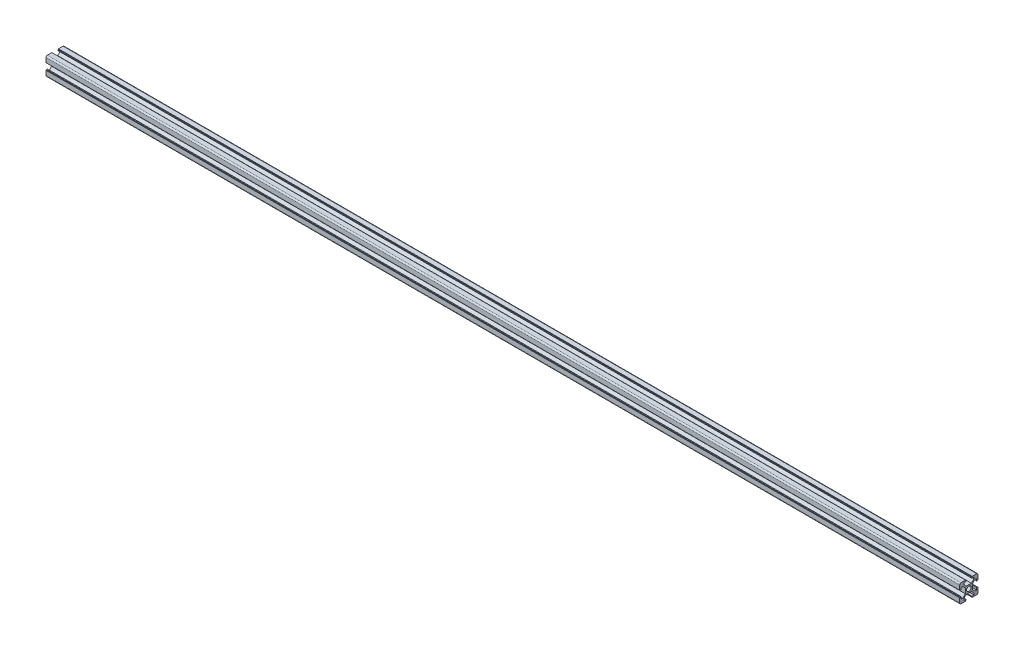
from build123d import *

# Parameters (mm, degrees)
SKETCH1_R                = 2.5
F_20_X_20_X_R1_5_1_DEPTH = 1000


with BuildPart() as part:
    # Sketch1 → 铝型材 20 X 20 X R1.5(1) (new body)
    with BuildSketch(Plane(origin=(0, 0, 0), x_dir=(0, 0, -1), z_dir=(1, 0, 0))):
        with BuildLine():
            Line((-3.6, 10), (-3.6, 9.5))
            Line((-3.6, 9.5), (-3.1, 9.5))
            Line((-3.1, 9.5), (-3.1, 8.5))
            Line((-3.1, 8.5), (-5.5, 8.5))
            Line((-5.5, 8.5), (-5.5, 6.65))
            Line((-5.5, 6.65), (-2.75, 3.9))
            Line((-2.75, 3.9), (2.75, 3.9))
            Line((2.75, 3.9), (5.5, 6.65))
            Line((5.5, 6.65), (5.5, 8.5))
            Line((5.5, 8.5), (3.1, 8.5))
            Line((3.1, 8.5), (3.1, 9.5))
            Line((3.1, 9.5), (3.6, 9.5))
            Line((3.6, 9.5), (3.6, 10))
            Line((3.6, 10), (8.5, 10))
            ThreePointArc((8.5, 10), (9.560660172, 9.560660172), (10, 8.5))
            Line((10, 8.5), (10, 3.6))
            Line((10, 3.6), (9.5, 3.6))
            Line((9.5, 3.6), (9.5, 3.1))
            Line((9.5, 3.1), (8.5, 3.1))
            Line((8.5, 3.1), (8.5, 5.5))
            Line((8.5, 5.5), (6.65, 5.5))
            Line((6.65, 5.5), (3.9, 2.75))
            Line((3.9, 2.75), (3.9, -2.75))
            Line((3.9, -2.75), (6.65, -5.5))
            Line((6.65, -5.5), (8.5, -5.5))
            Line((8.5, -5.5), (8.5, -3.1))
            Line((8.5, -3.1), (9.5, -3.1))
            Line((9.5, -3.1), (9.5, -3.6))
            Line((9.5, -3.6), (10, -3.6))
            Line((10, -3.6), (10, -8.5))
            ThreePointArc((10, -8.5), (9.560660172, -9.560660172), (8.5, -10))
            Line((8.5, -10), (3.6, -10))
            Line((3.6, -10), (3.6, -9.5))
            Line((3.6, -9.5), (3.1, -9.5))
            Line((3.1, -9.5), (3.1, -8.5))
            Line((3.1, -8.5), (5.5, -8.5))
            Line((5.5, -8.5), (5.5, -6.65))
            Line((5.5, -6.65), (2.75, -3.9))
            Line((2.75, -3.9), (-2.75, -3.9))
            Line((-2.75, -3.9), (-5.5, -6.65))
            Line((-5.5, -6.65), (-5.5, -8.5))
            Line((-5.5, -8.5), (-3.1, -8.5))
            Line((-3.1, -8.5), (-3.1, -9.5))
            Line((-3.1, -9.5), (-3.6, -9.5))
            Line((-3.6, -9.5), (-3.6, -10))
            Line((-3.6, -10), (-8.5, -10))
            ThreePointArc((-8.5, -10), (-9.560660172, -9.560660172), (-10, -8.5))
            Line((-10, -8.5), (-10, -3.6))
            Line((-10, -3.6), (-9.5, -3.6))
            Line((-9.5, -3.6), (-9.5, -3.1))
            Line((-9.5, -3.1), (-8.5, -3.1))
            Line((-8.5, -3.1), (-8.5, -5.5))
            Line((-8.5, -5.5), (-6.65, -5.5))
            Line((-6.65, -5.5), (-3.9, -2.75))
            Line((-3.9, -2.75), (-3.9, 2.75))
            Line((-3.9, 2.75), (-6.65, 5.5))
            Line((-6.65, 5.5), (-8.5, 5.5))
            Line((-8.5, 5.5), (-8.5, 3.1))
            Line((-8.5, 3.1), (-9.5, 3.1))
            Line((-9.5, 3.1), (-9.5, 3.6))
            Line((-9.5, 3.6), (-10, 3.6))
            Line((-10, 3.6), (-10, 8.5))
            ThreePointArc((-10, 8.5), (-9.560660172, 9.560660172), (-8.5, 10))
            Line((-8.5, 10), (-3.6, 10))
        make_face()
        Circle(SKETCH1_R, mode=Mode.SUBTRACT)
    extrude(amount=F_20_X_20_X_R1_5_1_DEPTH)


solid = part.part
